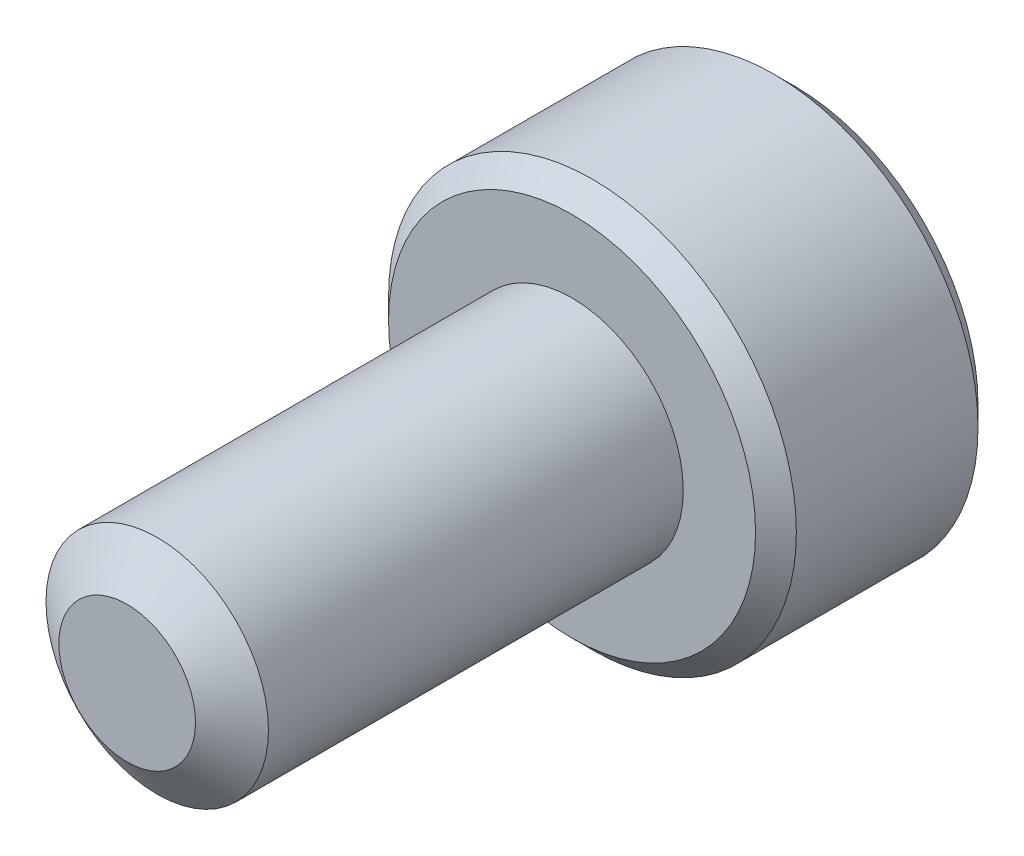
from build123d import *

# Parameters (mm, degrees)
SKETCH1_R          = 1.5
EXTRUDE1_DEPTH     = 6
SKETCH6_R          = 2.75
EXTRUDE2_DEPTH     = 3
CUT_EXTRUDE1_DEPTH = 1.875
CHAMFER1_SIZE      = 0.275


with BuildPart() as part:
    # Sketch1 → Extrude1 (new body)
    with BuildSketch(Plane.XY):
        Circle(SKETCH1_R)
    extrude(amount=-EXTRUDE1_DEPTH)

    # Sketch4 → Cut-Revolve1 (revolve, cut)
    with BuildSketch(Plane(origin=(0, 0, 0), x_dir=(0, 0, -1), z_dir=(1, 0, 0))):
        Polygon((0.405251783, 1.5), (0, 0.921240474), (0, 1.5), align=None)
    revolve(axis=Axis((0, 0, 0), (0, 0, -1)), mode=Mode.SUBTRACT)

    # Sketch6 → Extrude2 (add)
    with BuildSketch(Plane(origin=(0, 0, -6), x_dir=(-1, 0, 0), z_dir=(0, 0, -1))):
        Circle(SKETCH6_R)
    extrude(amount=EXTRUDE2_DEPTH)

    # Sketch7 → Cut-Extrude1 (cut)
    with BuildSketch(Plane(origin=(0, 0, -9), x_dir=(-1, 0, 0), z_dir=(0, 0, -1))):
        Polygon((0, 1.443375673), (-1.25, 0.721687836), (-1.25, -0.721687836), (0, -1.443375673), (1.25, -0.721687836), (1.25, 0.721687836), align=None)
    extrude(amount=-CUT_EXTRUDE1_DEPTH, mode=Mode.SUBTRACT)

    # Cut-Extrude2 cone 1 section (through the dimple's axis) → Cut-Extrude2 (revolve, cut)
    with BuildSketch(Plane(origin=(0, 0, -9), x_dir=(0, 1, 0), z_dir=(1, 0, 0))):
        Polygon((0, 0), (1.443375673, 0), (0, 1.443375673), align=None)
    revolve(axis=Axis((0, 0, -9), (0, 0, 1)), mode=Mode.SUBTRACT)

    # Chamfer1
    chamfer1_edges = [part.edges().sort_by_distance(p)[0] for p in [
        (2.75, 0, -9),
        (2.75, 0, -6),
    ]]
    chamfer(chamfer1_edges, length=CHAMFER1_SIZE)


solid = part.part
